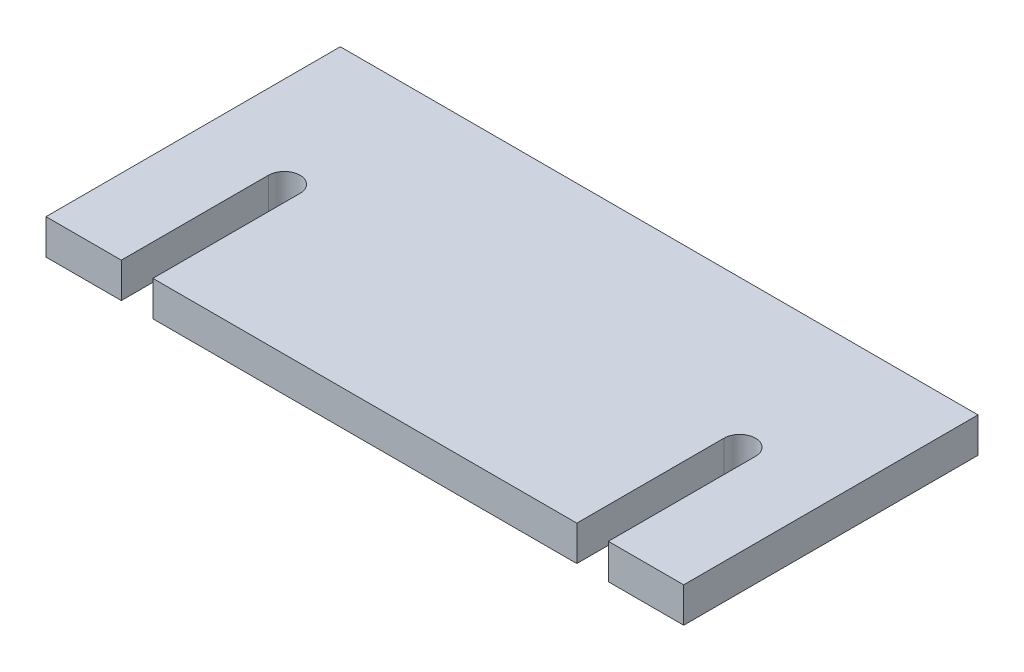
from build123d import *

# Parameters (mm, degrees)
SKETCH_1_W          = 91
SKETCH_1_H          = 42
EXTRUDE_1_DEPTH     = 5
CUT_EXTRUDE_1_DEPTH = 5


with BuildPart() as part:
    # 스케치1 → 보스-돌출1 (new body)
    with BuildSketch(Plane(origin=(0, 0, 0), x_dir=(1, 0, 0), z_dir=(0, 1, 0))):
        Rectangle(SKETCH_1_W, SKETCH_1_H)
    extrude(amount=EXTRUDE_1_DEPTH)

    # 스케치2 → 컷-돌출1 (cut)
    with BuildSketch(Plane(origin=(0, 5, 0), x_dir=(1, 0, 0), z_dir=(0, 1, 0))):
        with BuildLine():
            Line((34.75, 0), (34.75, -21))
            ThreePointArc((34.75, -21), (32.5, -23.25), (30.25, -21))
            Line((30.25, -21), (30.25, 0))
            ThreePointArc((30.25, 0), (32.5, 2.25), (34.75, 0))
        make_face()
        with BuildLine():
            Line((-30.25, 0), (-30.25, -21))
            ThreePointArc((-30.25, -21), (-32.5, -23.25), (-34.75, -21))
            Line((-34.75, -21), (-34.75, 0))
            ThreePointArc((-34.75, 0), (-32.5, 2.25), (-30.25, 0))
        make_face()
    extrude(amount=-CUT_EXTRUDE_1_DEPTH, mode=Mode.SUBTRACT)


solid = part.part
